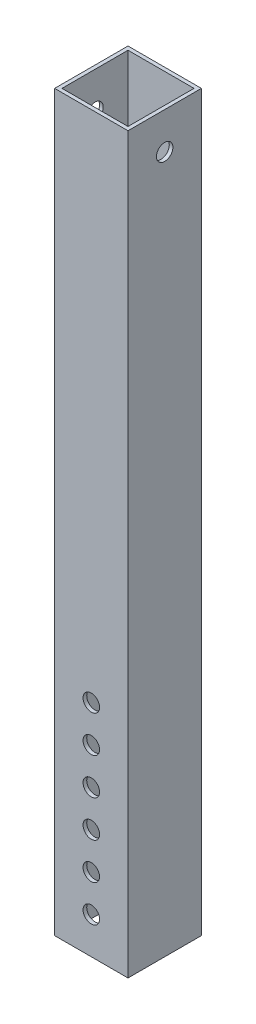
from build123d import *

# Parameters (mm, degrees)
SKETCH1_W           = 20
SKETCH1_H           = 20
SKETCH1_W_2         = 18
SKETCH1_H_2         = 18
BOSS_EXTRUDE1_DEPTH = 200
SKETCH2_R           = 2.25
CUT_EXTRUDE1_DEPTH  = 202.246117975
SKETCH3_R           = 2.25
CUT_EXTRUDE2_DEPTH  = 202.246117975


with BuildPart() as part:
    # Sketch1 → Boss-Extrude1 (new body)
    with BuildSketch(Plane(origin=(0, 0, 0), x_dir=(1, 0, 0), z_dir=(0, 1, 0))):
        Rectangle(SKETCH1_W, SKETCH1_H)
        Rectangle(SKETCH1_W_2, SKETCH1_H_2, mode=Mode.SUBTRACT)
    extrude(amount=BOSS_EXTRUDE1_DEPTH)

    # Sketch2 → Cut-Extrude1 (cut, through all)
    with BuildSketch(Plane.XY.offset(10)):
        with Locations((0, 10)):
            Circle(SKETCH2_R)
        with Locations((0, 20)):
            Circle(SKETCH2_R)
        with Locations((0, 30)):
            Circle(SKETCH2_R)
        with Locations((0, 40)):
            Circle(SKETCH2_R)
        with Locations((0, 50)):
            Circle(SKETCH2_R)
        with Locations((0, 60)):
            Circle(SKETCH2_R)
    extrude(amount=-CUT_EXTRUDE1_DEPTH, mode=Mode.SUBTRACT)

    # Sketch3 → Cut-Extrude2 (cut, through all)
    with BuildSketch(Plane(origin=(10, 0, 0), x_dir=(0, 0, -1), z_dir=(1, 0, 0))):
        with Locations((0, 190)):
            Circle(SKETCH3_R)
    extrude(amount=-CUT_EXTRUDE2_DEPTH, mode=Mode.SUBTRACT)


solid = part.part
